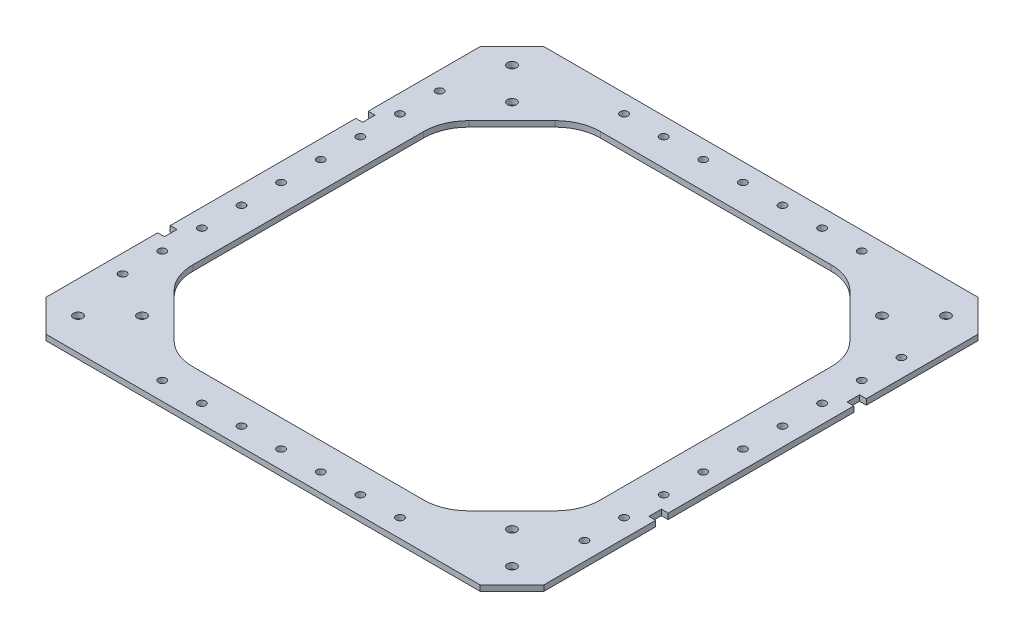
from build123d import *

# Parameters (mm, degrees)
BOSS_EXTRUDE1_DEPTH = 3.175
CUT_EXTRUDE4_DEPTH  = 235.179100055
SKETCH5_R           = 2.54
CUT_EXTRUDE3_DEPTH  = 235.179100055
SKETCH4_R           = 2.159
CUT_EXTRUDE2_DEPTH  = 235.179100055
FILLET1_R           = 25.4
SKETCH6_W           = 3.81
SKETCH6_H           = 6.985
CUT_EXTRUDE5_DEPTH  = 235.179100055


with BuildPart() as part:
    # Sketch1 → Boss-Extrude1 (new body)
    with BuildSketch(Plane(origin=(0, 0, 0), x_dir=(1, 0, 0), z_dir=(0, 1, 0))):
        Polygon((-139.7, 73.520142619), (-121.739487758, 91.480654861), (121.739487758, 91.480654861), (139.7, 73.520142619), (139.7, -169.958832897), (121.739487758, -187.919345139), (-121.739487758, -187.919345139), (-139.7, -169.958832897), align=None)
    extrude(amount=BOSS_EXTRUDE1_DEPTH)

    # Sketch2 → Cut-Extrude4 (cut, through all)
    with BuildSketch(Plane(origin=(0, 3.175, 0), x_dir=(1, 0, 0), z_dir=(0, 1, 0))):
        Polygon((-103.778975516, 37.599118134), (-114.3, 27.07809365), (-114.3, -123.516783928), (-103.778975516, -134.037808413), (-85.818463274, -151.998320655), (-75.297438789, -162.519345139), (75.297438789, -162.519345139), (85.818463274, -151.998320655), (103.778975516, -134.037808413), (114.3, -123.516783928), (114.3, 27.07809365), (103.778975516, 37.599118134), (85.818463274, 55.559630377), (75.297438789, 66.080654861), (-75.297438789, 66.080654861), (-85.818463274, 55.559630377), align=None)
    extrude(amount=-CUT_EXTRUDE4_DEPTH, mode=Mode.SUBTRACT)

    # Sketch5 → Cut-Extrude3 (cut, through all)
    with BuildSketch(Plane(origin=(0, 3.175, 0), x_dir=(1, 0, 0), z_dir=(0, 1, 0))):
        with Locations((-121.739487758, 73.520142619)):
            Circle(SKETCH5_R)
        with Locations((-103.778975516, 55.559630377)):
            Circle(SKETCH5_R)
        with Locations((103.778975516, 55.559630377)):
            Circle(SKETCH5_R)
        with Locations((121.739487758, 73.520142619)):
            Circle(SKETCH5_R)
        with Locations((121.739487758, -169.958832897)):
            Circle(SKETCH5_R)
        with Locations((103.778975516, -151.998320655)):
            Circle(SKETCH5_R)
        with Locations((-103.778975516, -151.998320655)):
            Circle(SKETCH5_R)
        with Locations((-121.739487758, -169.958832897)):
            Circle(SKETCH5_R)
    extrude(amount=-CUT_EXTRUDE3_DEPTH, mode=Mode.SUBTRACT)

    # Sketch4 → Cut-Extrude2 (cut, through all)
    with BuildSketch(Plane(origin=(0, 3.175, 0), x_dir=(1, 0, 0), z_dir=(0, 1, 0))):
        with Locations((0, 81.320654861)):
            Circle(SKETCH4_R)
        with Locations((-44.45, 81.320654861)):
            Circle(SKETCH4_R)
        with Locations((44.45, 81.320654861)):
            Circle(SKETCH4_R)
        with Locations((-22.225, 81.320654861)):
            Circle(SKETCH4_R)
        with Locations((22.225, 81.320654861)):
            Circle(SKETCH4_R)
        with Locations((-129.54, -48.219345139)):
            Circle(SKETCH4_R)
        with Locations((-129.54, -25.994345139)):
            Circle(SKETCH4_R)
        with Locations((-129.54, -3.769345139)):
            Circle(SKETCH4_R)
        with Locations((129.54, -48.219345139)):
            Circle(SKETCH4_R)
        with Locations((129.54, -25.994345139)):
            Circle(SKETCH4_R)
        with Locations((129.54, -3.769345139)):
            Circle(SKETCH4_R)
        with Locations((129.54, -92.669345139)):
            Circle(SKETCH4_R)
        with Locations((129.54, -70.444345139)):
            Circle(SKETCH4_R)
        with Locations((-129.54, -92.669345139)):
            Circle(SKETCH4_R)
        with Locations((-129.54, -70.444345139)):
            Circle(SKETCH4_R)
        with Locations((22.225, -177.759345139)):
            Circle(SKETCH4_R)
        with Locations((-22.225, -177.759345139)):
            Circle(SKETCH4_R)
        with Locations((44.45, -177.759345139)):
            Circle(SKETCH4_R)
        with Locations((-44.45, -177.759345139)):
            Circle(SKETCH4_R)
        with Locations((0, -177.759345139)):
            Circle(SKETCH4_R)
        with Locations((-66.675, 81.320654861)):
            Circle(SKETCH4_R)
        with Locations((66.675, 81.320654861)):
            Circle(SKETCH4_R)
        with Locations((-129.54, 18.455654861)):
            Circle(SKETCH4_R)
        with Locations((129.54, 18.455654861)):
            Circle(SKETCH4_R)
        with Locations((129.54, -114.894345139)):
            Circle(SKETCH4_R)
        with Locations((66.675, -177.759345139)):
            Circle(SKETCH4_R)
        with Locations((-66.675, -177.759345139)):
            Circle(SKETCH4_R)
        with Locations((-129.54, -114.894345139)):
            Circle(SKETCH4_R)
        with Locations((-129.54, -137.119345139)):
            Circle(SKETCH4_R)
        with Locations((-129.54, 40.680654861)):
            Circle(SKETCH4_R)
        with Locations((129.54, 40.680654861)):
            Circle(SKETCH4_R)
        with Locations((129.54, -137.119345139)):
            Circle(SKETCH4_R)
    extrude(amount=-CUT_EXTRUDE2_DEPTH, mode=Mode.SUBTRACT)

    # Fillet1
    fillet1_edges = [part.edges().sort_by_distance(p)[0] for p in [
        (114.3, 1.5875, 123.516783928),
        (75.297438789, 1.5875, 162.519345139),
        (-75.297438789, 1.5875, 162.519345139),
        (-114.3, 1.5875, 123.516783928),
        (114.3, 1.5875, -27.07809365),
        (75.297438789, 1.5875, -66.080654861),
        (-114.3, 1.5875, -27.07809365),
        (-75.297438789, 1.5875, -66.080654861),
    ]]
    fillet(fillet1_edges, radius=FILLET1_R)

    # Sketch6 → Cut-Extrude5 (cut, through all)
    with BuildSketch(Plane(origin=(0, 3.175, 0), x_dir=(1, 0, 0), z_dir=(0, 1, 0))):
        with Locations((-137.795, 7.343154861)):
            Rectangle(SKETCH6_W, SKETCH6_H)
        with Locations((-137.795, -103.781845139)):
            Rectangle(SKETCH6_W, SKETCH6_H)
        with Locations((137.795, -103.781845139)):
            Rectangle(SKETCH6_W, SKETCH6_H)
        with Locations((137.795, 7.343154861)):
            Rectangle(SKETCH6_W, SKETCH6_H)
    extrude(amount=-CUT_EXTRUDE5_DEPTH, mode=Mode.SUBTRACT)


solid = part.part
